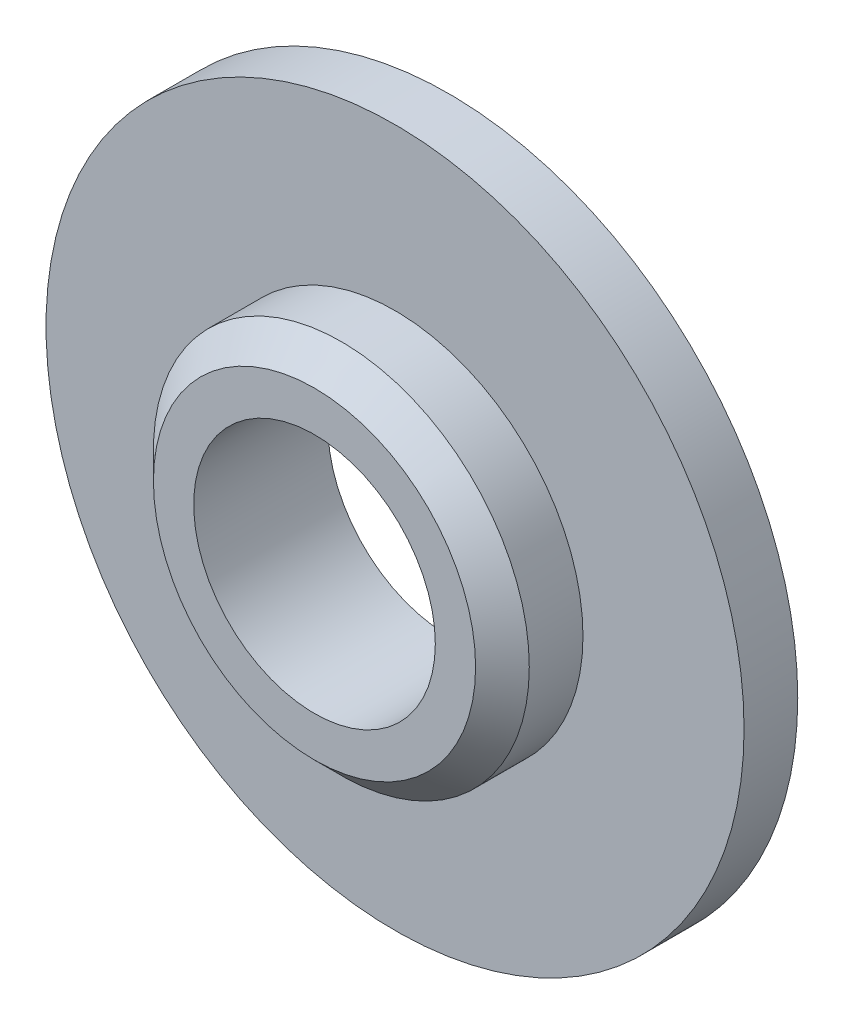
from build123d import *

# Parameters (mm, degrees)
SKETCH1_R           = 13
SKETCH1_R_2         = 4.5
BOSS_EXTRUDE1_DEPTH = 2
SKETCH1_3_R         = 7
SKETCH1_3_R_2       = 4.5
BOSS_EXTRUDE2_DEPTH = 5
CHAMFER1_SIZE       = 1


with BuildPart() as part:
    # Sketch1 → Boss-Extrude1 (new body)
    with BuildSketch(Plane.XY):
        Circle(SKETCH1_R)
        Circle(SKETCH1_R_2, mode=Mode.SUBTRACT)
    extrude(amount=BOSS_EXTRUDE1_DEPTH)

    # Sketch1<3> → Boss-Extrude2 (add)
    with BuildSketch(Plane.XY):
        Circle(SKETCH1_3_R)
        Circle(SKETCH1_3_R_2, mode=Mode.SUBTRACT)
    extrude(amount=BOSS_EXTRUDE2_DEPTH)

    # Chamfer1
    chamfer1_edges = [part.edges().sort_by_distance(p)[0] for p in [
        (-7, 0, 5),
    ]]
    chamfer(chamfer1_edges, length=CHAMFER1_SIZE)


solid = part.part
